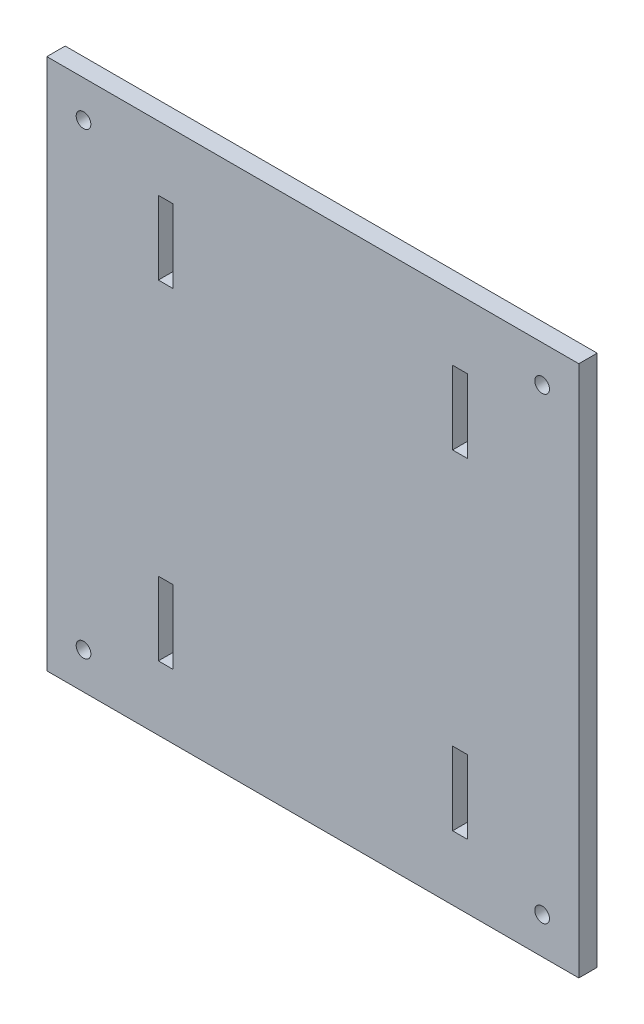
from build123d import *

# Parameters (mm, degrees)
ESQUISSE1_W             = 145
ESQUISSE1_H             = 145
BOSS_EXTRU_1_DEPTH      = 5
ESQUISSE3_W             = 4
ESQUISSE3_H             = 20
ENL_V_MAT_EXTRU_1_DEPTH = 5
ESQUISSE2_R             = 2
ENL_V_MAT_EXTRU_2_DEPTH = 5


with BuildPart() as part:
    # Esquisse1 → Boss.-Extru.1 (new body)
    with BuildSketch(Plane.XY):
        with Locations((39.504598951, 13.991761527)):
            Rectangle(ESQUISSE1_W, ESQUISSE1_H)
    extrude(amount=BOSS_EXTRU_1_DEPTH)

    # Esquisse3 → Enlèv. mat.-Extru.1 (cut)
    with BuildSketch(Plane.XY.offset(5)):
        with Locations((79.604598951, 58.941761527)):
            Rectangle(ESQUISSE3_W, ESQUISSE3_H)
        with Locations((-0.595401049, 58.941761527)):
            Rectangle(ESQUISSE3_W, ESQUISSE3_H)
        with Locations((-0.595401049, -30.958238473)):
            Rectangle(ESQUISSE3_W, ESQUISSE3_H)
        with Locations((79.604598951, -30.958238473)):
            Rectangle(ESQUISSE3_W, ESQUISSE3_H)
    extrude(amount=-ENL_V_MAT_EXTRU_1_DEPTH, mode=Mode.SUBTRACT)

    # Esquisse2 → Enlèv. mat.-Extru.2 (cut)
    with BuildSketch(Plane.XY.offset(5)):
        with Locations((-22.995401049, 76.491761527)):
            Circle(ESQUISSE2_R)
        with Locations((102.004598951, 76.491761527)):
            Circle(ESQUISSE2_R)
        with Locations((102.004598951, -48.508238473)):
            Circle(ESQUISSE2_R)
        with Locations((-22.995401049, -48.508238473)):
            Circle(ESQUISSE2_R)
    extrude(amount=-ENL_V_MAT_EXTRU_2_DEPTH, mode=Mode.SUBTRACT)


solid = part.part
